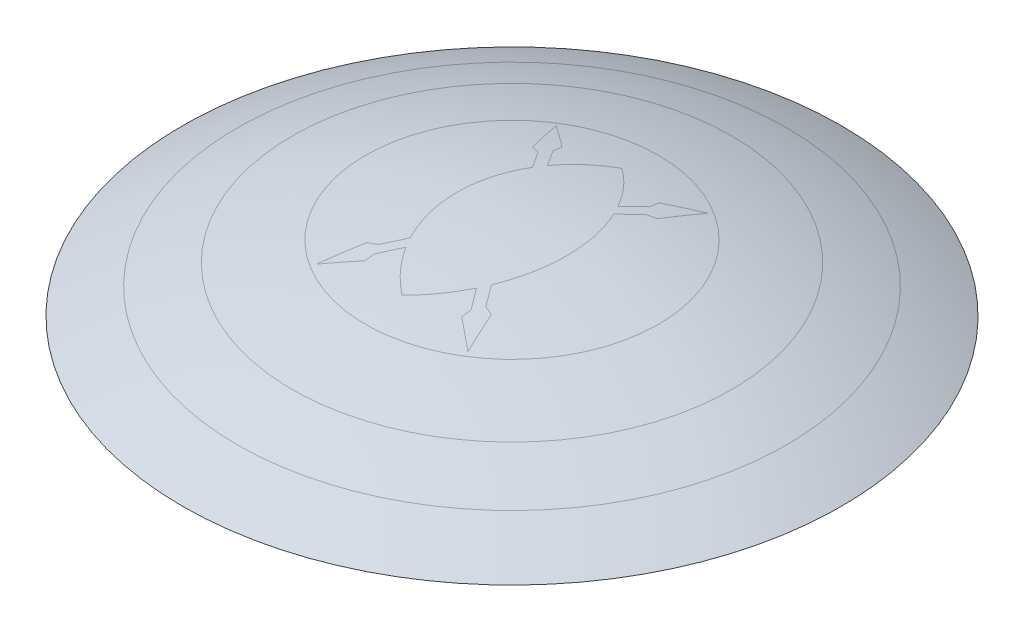
from build123d import *

# Parameters (mm, degrees)
SHELL1_T = -10


with BuildPart() as part:
    # Sketch2 → Revolve1 (revolve)
    with BuildSketch(Plane.XY):
        with BuildLine():
            Line((0, 0), (0, 90))
            ThreePointArc((0, 90), (185.290430675, 66.1617227), (360, 0))
            Line((360, 0), (0, 0))
        make_face()
    revolve(axis=Axis((0, 0, 0), (0, 1, 0)))

    # Shell1
    shell1_openings = [part.faces().sort_by_distance(p)[0] for p in [
        (0, 0, 0),
    ]]
    offset(amount=SHELL1_T, openings=shell1_openings)


solid = part.part
